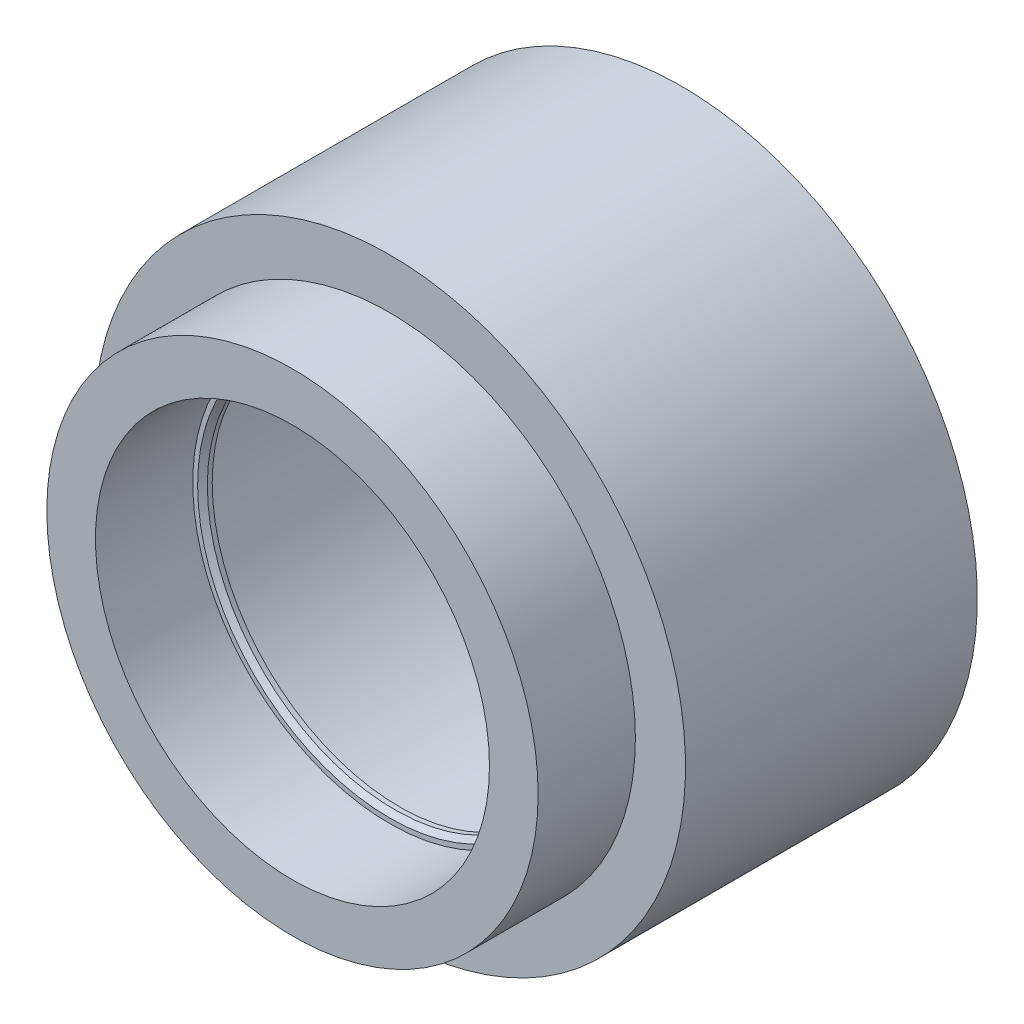
from build123d import *

# Parameters (mm, degrees)
SKETCH2_R           = 25.25
SKETCH2_R_2         = 20.25
BOSS_EXTRUDE1_DEPTH = 10
SKETCH3_R           = 30.4
SKETCH3_R_2         = 19.25
BOSS_EXTRUDE2_DEPTH = 30
SKETCH4_R           = 25.5
CUT_EXTRUDE1_DEPTH  = 29
CHAMFER2_SIZE       = 0.5


with BuildPart() as part:
    # Sketch2 → Boss-Extrude1 (new body)
    with BuildSketch(Plane.XY):
        Circle(SKETCH2_R)
        Circle(SKETCH2_R_2, mode=Mode.SUBTRACT)
    extrude(amount=BOSS_EXTRUDE1_DEPTH)

    # Sketch3 → Boss-Extrude2 (add)
    with BuildSketch(Plane(origin=(0, 0, 0), x_dir=(-1, 0, 0), z_dir=(0, 0, -1))):
        Circle(SKETCH3_R)
        Circle(SKETCH3_R_2, mode=Mode.SUBTRACT)
    extrude(amount=BOSS_EXTRUDE2_DEPTH)

    # Sketch4 → Cut-Extrude1 (cut)
    with BuildSketch(Plane(origin=(0, 0, -30), x_dir=(-1, 0, 0), z_dir=(0, 0, -1))):
        Circle(SKETCH4_R)
    extrude(amount=-CUT_EXTRUDE1_DEPTH, mode=Mode.SUBTRACT)

    # Chamfer2
    chamfer2_edges = [part.edges().sort_by_distance(p)[0] for p in [
        (19.25, 0, 0),
    ]]
    chamfer(chamfer2_edges, length=CHAMFER2_SIZE)


solid = part.part
